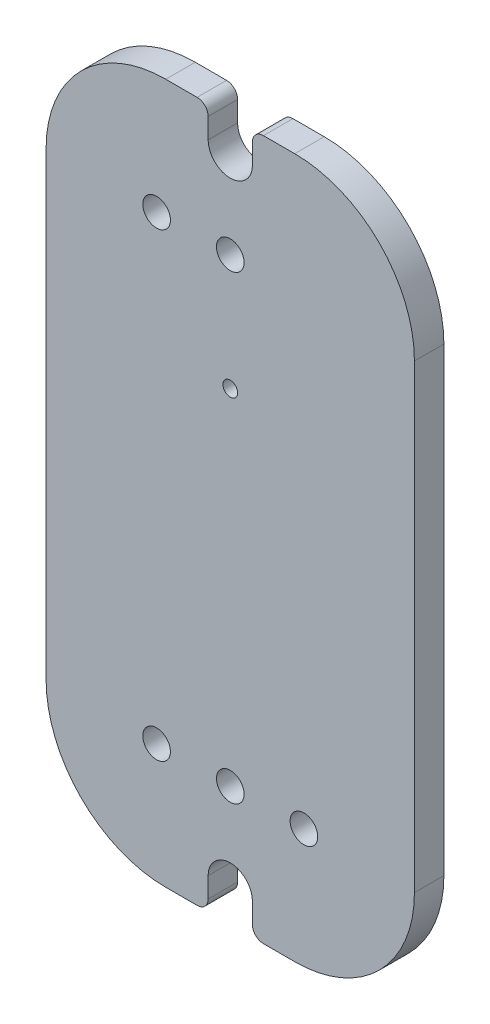
from build123d import *

# Parameters (mm, degrees)
BOARD_DEPTH            = 0.8
SKETCH2_R              = 0.375
NON_PLATED_HOLES_DEPTH = 11.765221781
SKETCH3_R              = 0.2
PLATED_HOLES_DEPTH     = 11.765221781


with BuildPart() as part:
    # Sketch1 → BOARD (new body)
    with BuildSketch(Plane.XY):
        with BuildLine():
            Line((-0.6, 8.65), (-0.6, 9.2))
            ThreePointArc((-0.6, 9.2), (-0.687867966, 9.412132034), (-0.9, 9.5))
            Line((-0.9, 9.5), (-1.75, 9.5))
            ThreePointArc((-1.75, 9.5), (-4.048097039, 8.548097039), (-5, 6.25))
            Line((-5, 6.25), (-5, -6.25))
            ThreePointArc((-5, -6.25), (-4.048097039, -8.548097039), (-1.75, -9.5))
            Line((-1.75, -9.5), (-0.9, -9.5))
            ThreePointArc((-0.9, -9.5), (-0.687867966, -9.412132034), (-0.6, -9.2))
            Line((-0.6, -9.2), (-0.6, -8.65))
            ThreePointArc((-0.6, -8.65), (-0.424264069, -8.225735931), (0, -8.05))
            ThreePointArc((0, -8.05), (0.424264069, -8.225735931), (0.6, -8.65))
            Line((0.6, -8.65), (0.6, -9.2))
            ThreePointArc((0.6, -9.2), (0.687867966, -9.412132034), (0.9, -9.5))
            Line((0.9, -9.5), (1.75, -9.5))
            ThreePointArc((1.75, -9.5), (4.048097039, -8.548097039), (5, -6.25))
            Line((5, -6.25), (5, 6.25))
            ThreePointArc((5, 6.25), (4.048097039, 8.548097039), (1.75, 9.5))
            Line((1.75, 9.5), (0.9, 9.5))
            ThreePointArc((0.9, 9.5), (0.687867966, 9.412132034), (0.6, 9.2))
            Line((0.6, 9.2), (0.6, 8.65))
            ThreePointArc((0.6, 8.65), (0.424264069, 8.225735931), (0, 8.05))
            ThreePointArc((0, 8.05), (-0.424264069, 8.225735931), (-0.6, 8.65))
        make_face()
    extrude(amount=BOARD_DEPTH)

    # Sketch2 → NON-PLATED HOLES (cut, through all)
    with BuildSketch(Plane.XY):
        with Locations((2, -6.25)):
            Circle(SKETCH2_R)
        with Locations((0, -6.25)):
            Circle(SKETCH2_R)
        with Locations((-2, -6.25)):
            Circle(SKETCH2_R)
        with Locations((-2, 6.25)):
            Circle(SKETCH2_R)
        with Locations((0, 6.25)):
            Circle(SKETCH2_R)
    extrude(amount=NON_PLATED_HOLES_DEPTH, mode=Mode.SUBTRACT)

    # Sketch3 → PLATED HOLES (cut, through all)
    with BuildSketch(Plane.XY):
        with Locations((0, 3.1)):
            Circle(SKETCH3_R)
    extrude(amount=PLATED_HOLES_DEPTH, mode=Mode.SUBTRACT)


solid = part.part
